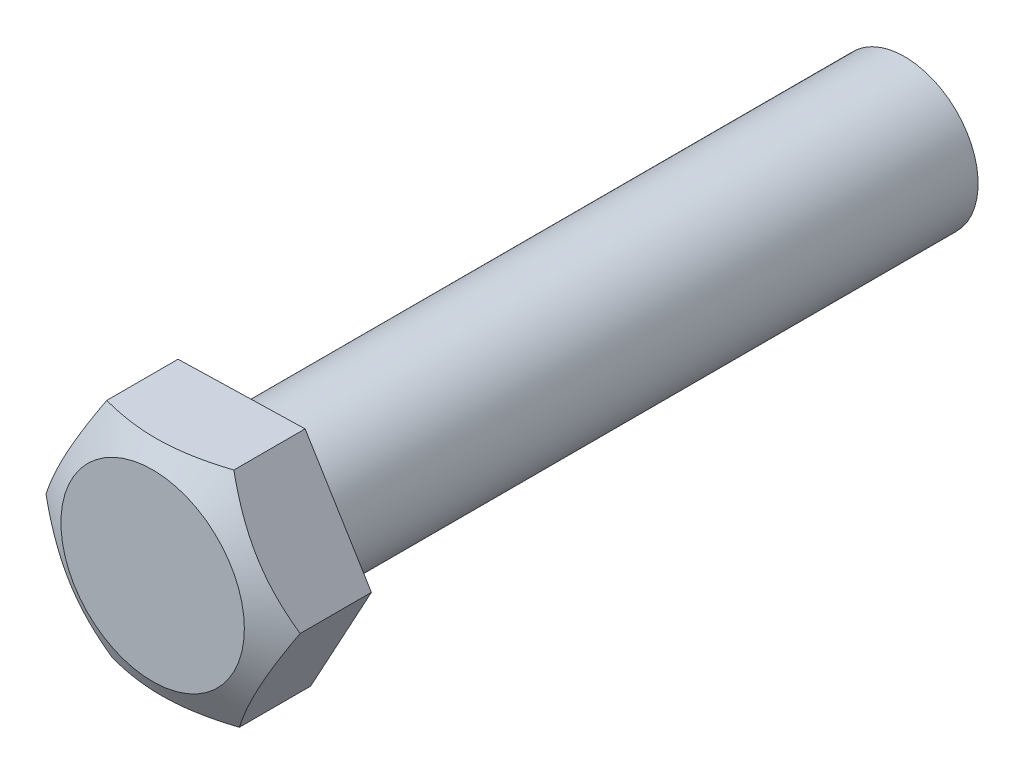
from build123d import *

# Parameters (mm, degrees)
SKETCH1_R           = 10
BOSS_EXTRUDE1_DEPTH = 90
BOSS_EXTRUDE2_DEPTH = 12.5
SKETCH4_OUTSIDE_W   = 76.428
SKETCH4_OUTSIDE_H   = 72.224
SKETCH4_OUTSIDE_R   = 12.5
CUT_EXTRUDE2_DEPTH  = 5
CUT_EXTRUDE2_DRAFT  = -60


with BuildPart() as part:
    # Sketch1 → Boss-Extrude1 (new body)
    with BuildSketch(Plane.XY):
        with Locations(Location((0, 0, 0), (0, 0, 180))):
            Circle(SKETCH1_R)
    extrude(amount=BOSS_EXTRUDE1_DEPTH)

    # Sketch3 → Boss-Extrude2 (add)
    with BuildSketch(Plane.XY.offset(90)):
        Polygon((8.280492797, 15.212936569), (-9.034543136, 14.777585402), (-17.315035933, -0.435351166), (-8.280492797, -15.212936569), (9.034543136, -14.777585402), (17.315035933, 0.435351166), align=None)
    extrude(amount=BOSS_EXTRUDE2_DEPTH)


with BuildPart() as cut_extrude2_tool:
    # Sketch4 outside → Cut-Extrude2 (with draft: the straight prism first)
    with BuildSketch(Plane.XY.offset(102.5)):
        Rectangle(SKETCH4_OUTSIDE_W, SKETCH4_OUTSIDE_H)
        Circle(SKETCH4_OUTSIDE_R, mode=Mode.SUBTRACT)
    extrude(amount=-CUT_EXTRUDE2_DEPTH)
    # Cut-Extrude2: the draft: its side faces are tilted about the plane it starts from
    cut_extrude2_sides = [cut_extrude2_tool.faces().sort_by_distance(p)[0] for p in [
        (0, -36.112, 100),
        (38.214, 0, 100),
        (0, 36.112, 100),
        (-38.214, 0, 100),
        (-12.5, 0, 100),
    ]]
    draft(cut_extrude2_sides, Plane.XY.offset(102.5), CUT_EXTRUDE2_DRAFT)


with BuildPart() as part_1:
    add(part.part)

    # Cut-Extrude2: cut by cut_extrude2_tool
    add(cut_extrude2_tool.part, mode=Mode.SUBTRACT)


solid = part_1.part
